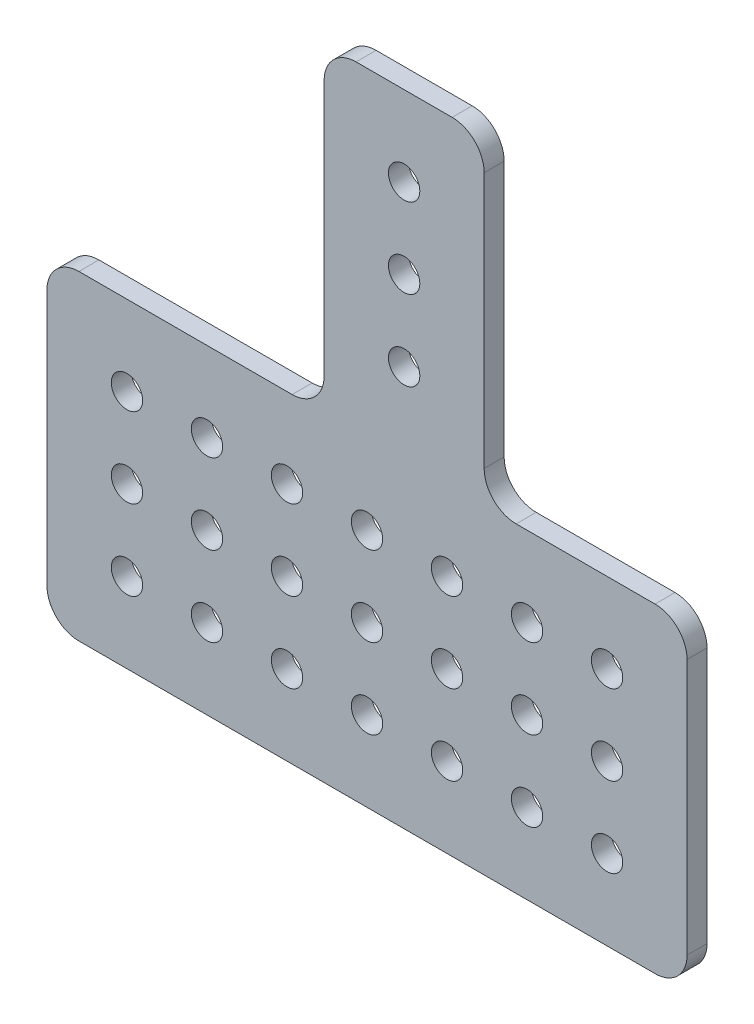
from build123d import *

# Parameters (mm, degrees)
SKETCH1_W           = 101.6
SKETCH1_H           = 50.8
SKETCH1_R           = 2.4892
SKETCH1_W_2         = 25.4
BOSS_EXTRUDE1_DEPTH = 1.5875
FILLET1_R           = 5.08


with BuildPart() as part:
    # Sketch1 → Boss-Extrude1 (new, symmetric)
    # profile 1 of 2: a face of its own
    with BuildSketch(Plane.XY):
        with Locations((50.8, -25.4)):
            Rectangle(SKETCH1_W, SKETCH1_H)
        with Locations((12.7, -12.7)):
            Circle(SKETCH1_R, mode=Mode.SUBTRACT)
        with Locations((12.7, -25.4)):
            Circle(SKETCH1_R, mode=Mode.SUBTRACT)
        with Locations((88.9, -12.7)):
            Circle(SKETCH1_R, mode=Mode.SUBTRACT)
        with Locations((76.2, -12.7)):
            Circle(SKETCH1_R, mode=Mode.SUBTRACT)
        with Locations((63.5, -12.7)):
            Circle(SKETCH1_R, mode=Mode.SUBTRACT)
        with Locations((50.8, -12.7)):
            Circle(SKETCH1_R, mode=Mode.SUBTRACT)
        with Locations((38.1, -12.7)):
            Circle(SKETCH1_R, mode=Mode.SUBTRACT)
        with Locations((25.4, -12.7)):
            Circle(SKETCH1_R, mode=Mode.SUBTRACT)
        with Locations((88.9, -25.4)):
            Circle(SKETCH1_R, mode=Mode.SUBTRACT)
        with Locations((76.2, -25.4)):
            Circle(SKETCH1_R, mode=Mode.SUBTRACT)
        with Locations((63.5, -25.4)):
            Circle(SKETCH1_R, mode=Mode.SUBTRACT)
        with Locations((50.8, -25.4)):
            Circle(SKETCH1_R, mode=Mode.SUBTRACT)
        with Locations((38.1, -25.4)):
            Circle(SKETCH1_R, mode=Mode.SUBTRACT)
        with Locations((25.4, -25.4)):
            Circle(SKETCH1_R, mode=Mode.SUBTRACT)
        with Locations((88.9, -38.1)):
            Circle(SKETCH1_R, mode=Mode.SUBTRACT)
        with Locations((76.2, -38.1)):
            Circle(SKETCH1_R, mode=Mode.SUBTRACT)
        with Locations((63.5, -38.1)):
            Circle(SKETCH1_R, mode=Mode.SUBTRACT)
        with Locations((50.8, -38.1)):
            Circle(SKETCH1_R, mode=Mode.SUBTRACT)
        with Locations((38.1, -38.1)):
            Circle(SKETCH1_R, mode=Mode.SUBTRACT)
        with Locations((25.4, -38.1)):
            Circle(SKETCH1_R, mode=Mode.SUBTRACT)
        with Locations((12.7, -38.1)):
            Circle(SKETCH1_R, mode=Mode.SUBTRACT)
    # profile 2 of 2: a face of its own
    with BuildSketch(Plane.XY):
        with Locations((56.6928, 25.4)):
            Rectangle(SKETCH1_W_2, SKETCH1_H)
        with Locations((56.6928, 12.7)):
            Circle(SKETCH1_R, mode=Mode.SUBTRACT)
        with Locations((56.6928, 25.4)):
            Circle(SKETCH1_R, mode=Mode.SUBTRACT)
        with Locations((56.6928, 38.1)):
            Circle(SKETCH1_R, mode=Mode.SUBTRACT)
    extrude(amount=BOSS_EXTRUDE1_DEPTH, both=True)

    # Fillet1
    fillet1_edges = [part.edges().sort_by_distance(p)[0] for p in [
        (101.6, -50.8, 0),
        (0, -50.8, 0),
        (0, 0, 0),
        (43.9928, 0, 0),
        (43.9928, 50.8, 0),
        (69.3928, 50.8, 0),
        (69.3928, 0, 0),
        (101.6, 0, 0),
    ]]
    fillet(fillet1_edges, radius=FILLET1_R)


solid = part.part
